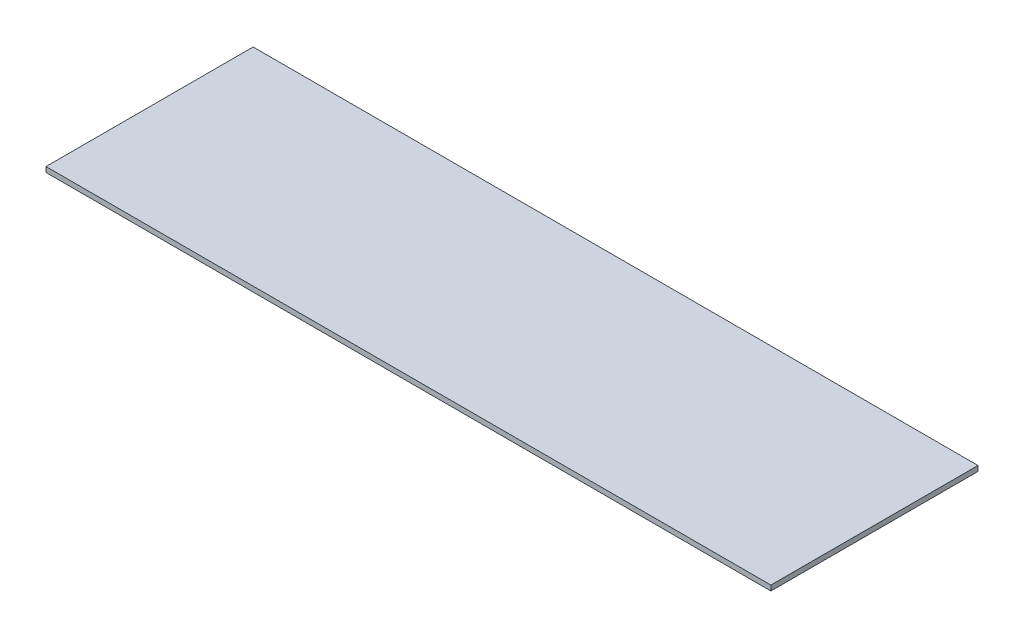
from build123d import *

# Parameters (mm, degrees)
SKETCH1_W           = 140
SKETCH1_H           = 40
BOSS_EXTRUDE1_DEPTH = 1


with BuildPart() as part:
    # Sketch1 → Boss-Extrude1 (new body)
    with BuildSketch(Plane(origin=(0, 0, 0), x_dir=(1, 0, 0), z_dir=(0, 1, 0))):
        Rectangle(SKETCH1_W, SKETCH1_H)
    extrude(amount=BOSS_EXTRUDE1_DEPTH)


solid = part.part
